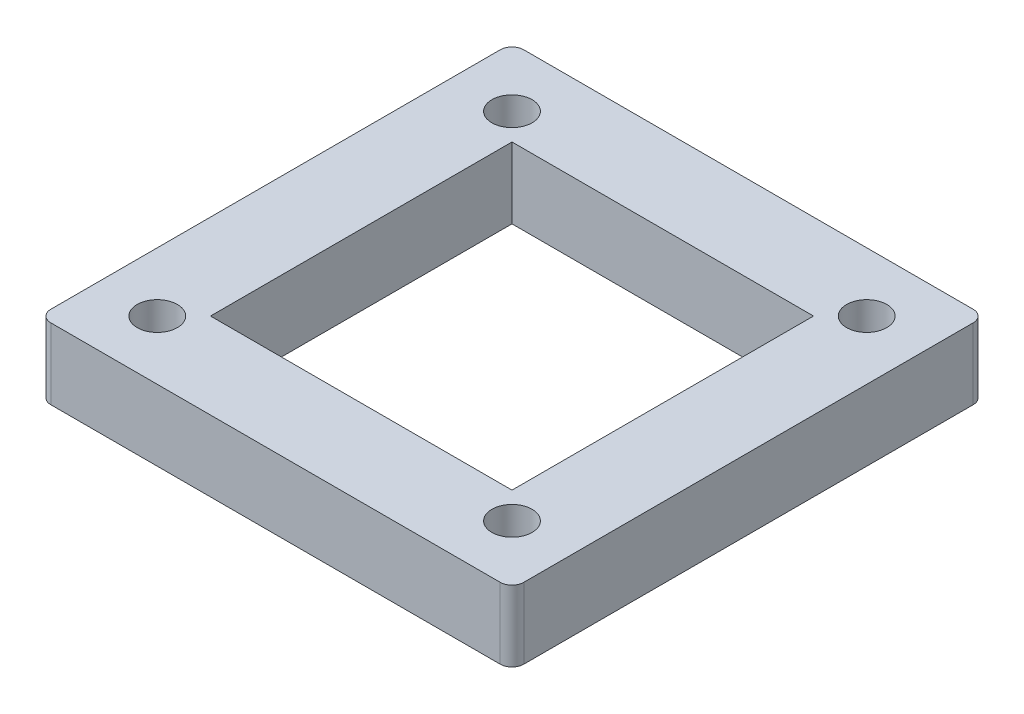
from build123d import *

# Parameters (mm, degrees)
SKETCH1_W           = 40
SKETCH1_H           = 40
SKETCH1_W_2         = 25.5
SKETCH1_H_2         = 25.5
BOSS_EXTRUDE1_DEPTH = 6
SKETCH5_R           = 1.7
CUT_EXTRUDE1_DEPTH  = 29.91366459
FILLET1_R           = 1


with BuildPart() as part:
    # Sketch1 → Boss-Extrude1 (new body)
    with BuildSketch(Plane(origin=(0, 0, 0), x_dir=(1, 0, 0), z_dir=(0, 1, 0))):
        Rectangle(SKETCH1_W, SKETCH1_H)
        Rectangle(SKETCH1_W_2, SKETCH1_H_2, mode=Mode.SUBTRACT)
    extrude(amount=BOSS_EXTRUDE1_DEPTH)

    # Sketch5 → Cut-Extrude1 (cut, through all)
    with BuildSketch(Plane.XZ.offset(-6)):
        with Locations(Location((-15, 15, 0), (0, 0, 270))):
            Circle(SKETCH5_R)
        with Locations(Location((-15, -15, 0), (0, 0, 270))):
            Circle(SKETCH5_R)
        with Locations(Location((15, -15, 0), (0, 0, 270))):
            Circle(SKETCH5_R)
        with Locations(Location((15, 15, 0), (0, 0, 270))):
            Circle(SKETCH5_R)
    extrude(amount=CUT_EXTRUDE1_DEPTH, mode=Mode.SUBTRACT)

    # Fillet1
    fillet1_edges = [part.edges().sort_by_distance(p)[0] for p in [
        (20, 3, 20),
        (-20, 3, 20),
        (-20, 3, -20),
        (20, 3, -20),
    ]]
    fillet(fillet1_edges, radius=FILLET1_R)


solid = part.part
